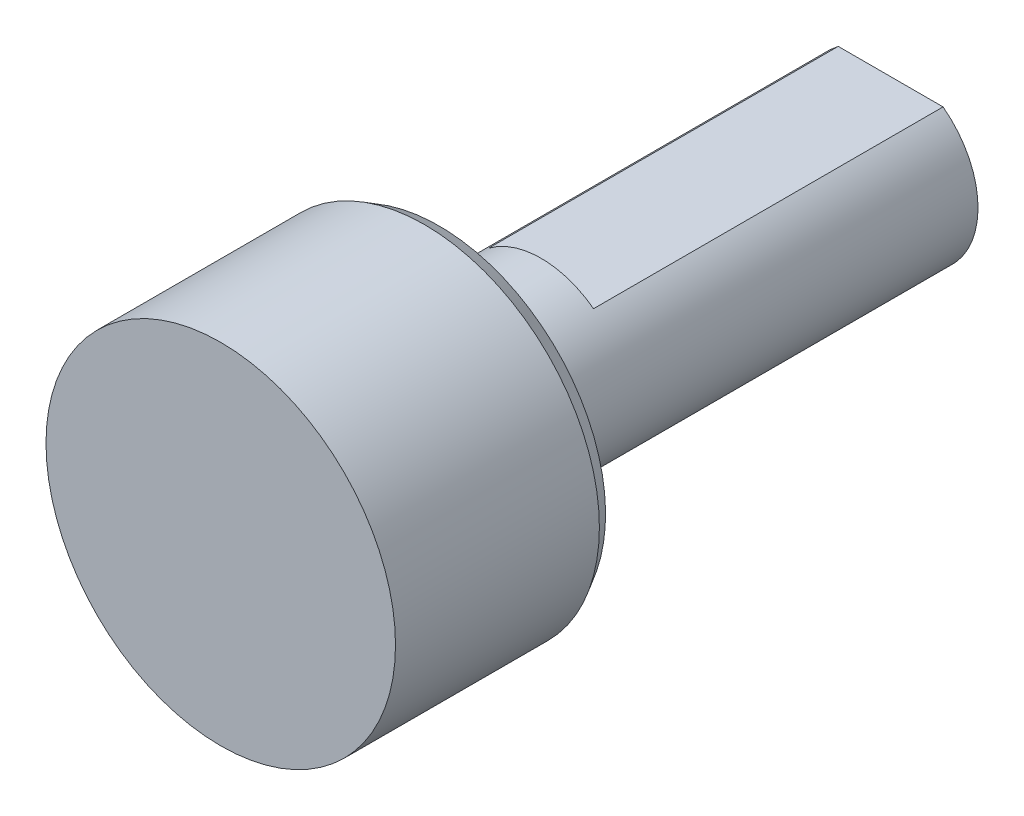
from build123d import *

# Parameters (mm, degrees)
CROQUIS5_W            = 12
CROQUIS5_H            = 0.6
CORTAR_EXTRUIR2_DEPTH = 3


with BuildPart() as part:
    # Croquis2 → Revolución1 (revolve)
    with BuildSketch(Plane(origin=(0, 0, 7), x_dir=(0, 0, 1), z_dir=(-1, 0, 0)), mode=Mode.PRIVATE) as revoluci_n1_sk:
        Polygon((-7, 0), (-30, 0), (-30, 3), (-14.5, 3), (-14.5, 5.711324865), (-14, 6), (-7, 6), align=None)
    revolve(revoluci_n1_sk.sketch.rotate(Axis((0, 0, 0), (0, 0, -1)), 180), axis=Axis((0, 0, 0), (0, 0, -1)))

    # Croquis5 → Cortar-Extruir2 (cut, symmetric)
    with BuildSketch(Plane(origin=(0, 0, 0), x_dir=(0, 0, -1), z_dir=(1, 0, 0))):
        with Locations((17, 2.7)):
            Rectangle(CROQUIS5_W, CROQUIS5_H)
    extrude(amount=CORTAR_EXTRUIR2_DEPTH, both=True, mode=Mode.SUBTRACT)


solid = part.part
